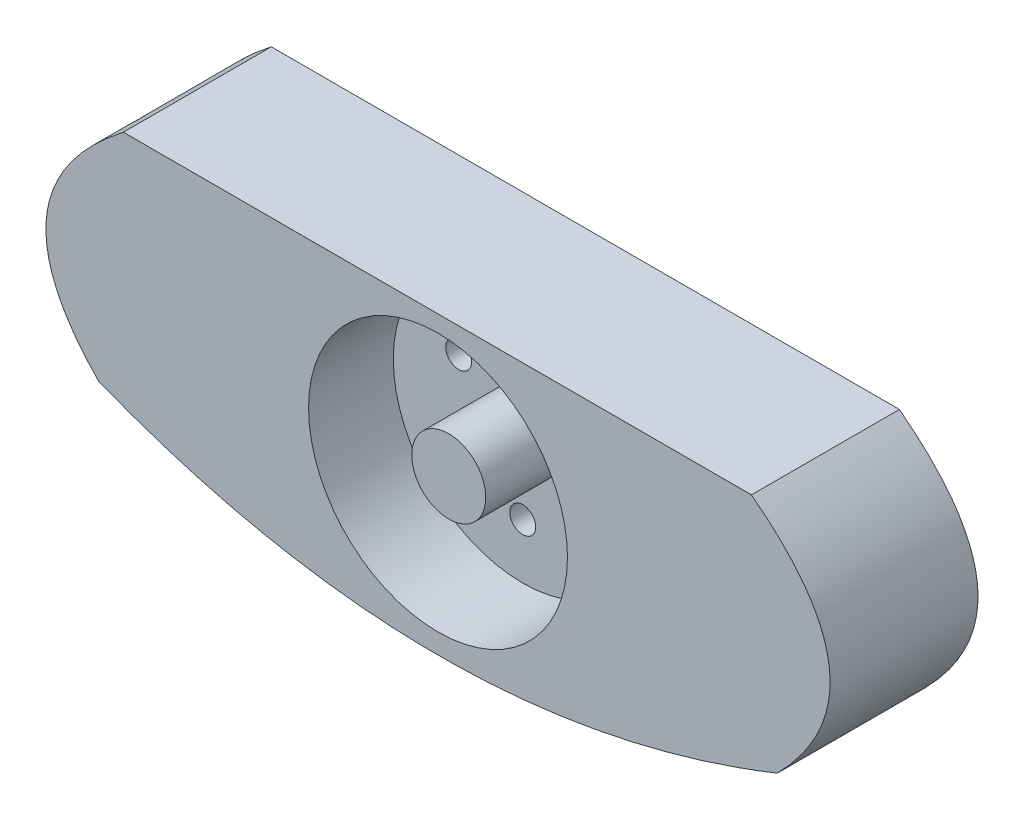
from build123d import *

# Parameters (mm, degrees)
BOSS_EXTRUDE1_DEPTH                              = 20
SKETCH4_R                                        = 17.5
CUT_EXTRUDE1_DEPTH                               = 11.453250926
SKETCH5_R                                        = 5
BOSS_EXTRUDE2_DEPTH                              = 10
CBORE_FOR_M5_HEX_HEAD_MACHINE_SCREW2_D           = 3.5
CBORE_FOR_M5_HEX_HEAD_MACHINE_SCREW2_DEPTH       = 11
CBORE_FOR_M5_HEX_HEAD_MACHINE_SCREW2_CBORE_D     = 7
CBORE_FOR_M5_HEX_HEAD_MACHINE_SCREW2_CBORE_DEPTH = 4
CBORE_FOR_M5_HEX_HEAD_MACHINE_SCREW2_TIP         = 1.75


with BuildPart() as part:
    # Sketch2 → Boss-Extrude1 (new body)
    with BuildSketch(Plane.XY):
        with BuildLine():
            Line((42.376776125, 8.683218748), (-42.540089832, 8.683218747))
            add(Edge.make_bspline(
                [(-42.540089832, 8.683218747), (-61.647606257, -6.072667773), (-45.873698376, -22.15549797)],
                knots=[0, 0, 0, 1, 1, 1], degree=2))
            add(Edge.make_bspline(
                [(-45.873698376, -22.15549797), (0.203235462, -40.398996626), (45.873698397, -22.155497949)],
                knots=[0, 0, 0, 1, 1, 1], degree=2))
            add(Edge.make_bspline(
                [(45.873698397, -22.155497949), (61.713202875, -6.005950809), (42.376776125, 8.683218748)],
                knots=[0, 0, 0, 1, 1, 1], degree=2))
        make_face()
    extrude(amount=BOSS_EXTRUDE1_DEPTH)

    # Sketch4 → Cut-Extrude1 (cut)
    with BuildSketch(Plane.XY.offset(20)):
        with Locations((0, -11.063024907)):
            Circle(SKETCH4_R)
    extrude(amount=-CUT_EXTRUDE1_DEPTH, mode=Mode.SUBTRACT)

    # Sketch5 → Boss-Extrude2 (add)
    with BuildSketch(Plane.XY.offset(8.546749074)):
        with Locations((0, -11.063024907)):
            Circle(SKETCH5_R)
    extrude(amount=BOSS_EXTRUDE2_DEPTH)

    # CBORE for M5 Hex Head Machine Screw2
    with Locations(Plane(origin=(0, 0, 0), x_dir=(-1, 0, 0), z_dir=(0, 0, -1))):
        with Locations((-8.660254038, -6.129479586), (0, -21.129479586), (8.660254038, -6.129479586)):
            CounterBoreHole(CBORE_FOR_M5_HEX_HEAD_MACHINE_SCREW2_D / 2, CBORE_FOR_M5_HEX_HEAD_MACHINE_SCREW2_CBORE_D / 2, CBORE_FOR_M5_HEX_HEAD_MACHINE_SCREW2_CBORE_DEPTH, depth=CBORE_FOR_M5_HEX_HEAD_MACHINE_SCREW2_DEPTH)
            with Locations((0, 0, -(CBORE_FOR_M5_HEX_HEAD_MACHINE_SCREW2_DEPTH + CBORE_FOR_M5_HEX_HEAD_MACHINE_SCREW2_TIP / 2))):  # 90° drill point
                Cone(0, CBORE_FOR_M5_HEX_HEAD_MACHINE_SCREW2_D / 2, CBORE_FOR_M5_HEX_HEAD_MACHINE_SCREW2_TIP, mode=Mode.SUBTRACT)


solid = part.part
